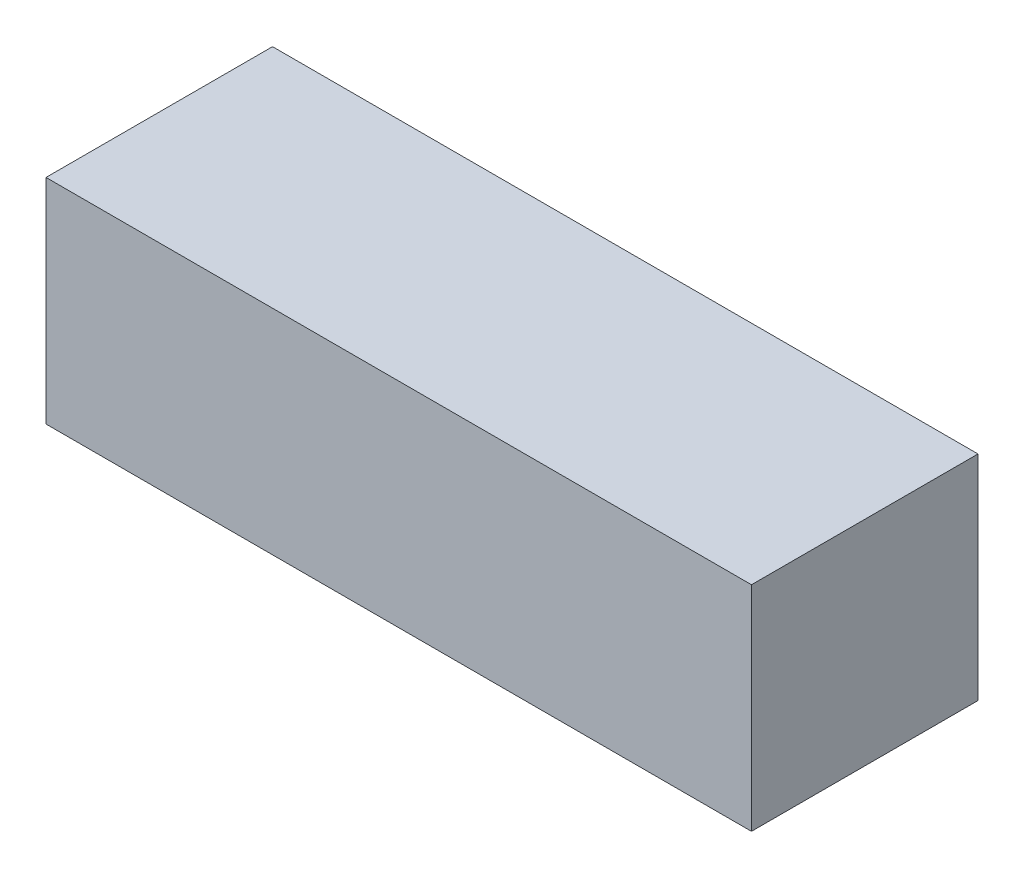
from build123d import *

# Parameters (mm, degrees)
SKETCH1_W           = 109
SKETCH1_H           = 35
BOSS_EXTRUDE1_DEPTH = 16.5


with BuildPart() as part:
    # Sketch1 → Boss-Extrude1 (new, symmetric)
    with BuildSketch(Plane(origin=(0, 0, 0), x_dir=(1, 0, 0), z_dir=(0, 1, 0))):
        Rectangle(SKETCH1_W, SKETCH1_H)
    extrude(amount=BOSS_EXTRUDE1_DEPTH, both=True)


solid = part.part
